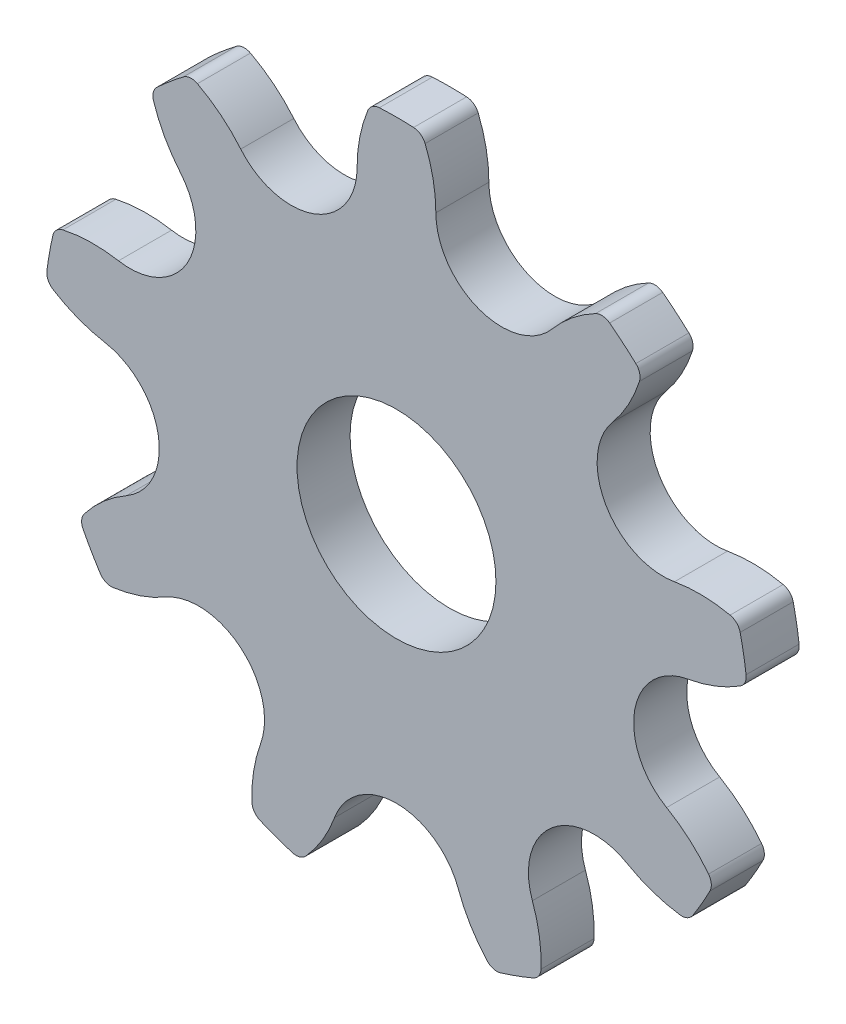
from build123d import *

# Parameters (mm, degrees)
BOSS_EXTRUDE1_DEPTH = 3.2
SKETCH2_R           = 6
CUT_EXTRUDE1_DEPTH  = 10


with BuildPart() as part:
    # Sketch1 → Boss-Extrude1 (new body)
    with BuildSketch(Plane.XY):
        with BuildLine():
            ThreePointArc((2.3749, 17.446481614), (2.211827147, 19.125468185), (1.72870442, 20.741692518))
            ThreePointArc((1.72870442, 20.741692518), (1.452377955, 21.089746522), (1.03228327, 21.234723622))
            ThreePointArc((1.03228327, 21.234723622), (0, 21.2598), (-1.03228327, 21.234723622))
            ThreePointArc((-1.03228327, 21.234723622), (-1.452377955, 21.089746522), (-1.72870442, 20.741692518))
            ThreePointArc((-1.72870442, 20.741692518), (-2.211827147, 19.125468185), (-2.3749, 17.446481614))
            ThreePointArc((-2.3749, 17.446481614), (-4.990435728, 13.711109477), (-9.395103266, 14.891336586))
            ThreePointArc((-9.395103266, 14.891336586), (-10.599256083, 16.07269371), (-12.00823854, 17.000248076))
            ThreePointArc((-12.00823854, 17.000248076), (-12.443641694, 17.089253684), (-12.858642377, 16.930280927))
            ThreePointArc((-12.858642377, 16.930280927), (-13.665536024, 16.285951652), (-14.440192102, 15.603203136))
            ThreePointArc((-14.440192102, 15.603203136), (-14.668813817, 15.222112575), (-14.656767369, 14.777868512))
            ThreePointArc((-14.656767369, 14.777868512), (-13.987971874, 13.22922354), (-13.033661162, 11.838223998))
            ThreePointArc((-13.033661162, 11.838223998), (-12.636226845, 7.295528971), (-16.769033299, 5.368369672))
            ThreePointArc((-16.769033299, 5.368369672), (-18.450829595, 5.49932722), (-20.12639323, 5.304198623))
            ThreePointArc((-20.12639323, 5.304198623), (-20.517143098, 5.092509122), (-20.732866347, 4.703971627))
            ThreePointArc((-20.732866347, 4.703971627), (-20.936815867, 3.691725528), (-21.091374564, 2.670770493))
            ThreePointArc((-21.091374564, 2.670770493), (-21.021548669, 2.23188298), (-20.726765974, 1.899315592))
            ThreePointArc((-20.726765974, 1.899315592), (-19.218989102, 1.142878174), (-17.593827413, 0.690729806))
            ThreePointArc((-17.593827413, 0.690729806), (-14.369386985, -2.533710622), (-16.296546284, -6.666517075))
            ThreePointArc((-16.296546284, -6.666517075), (-17.669054881, -7.647235594), (-18.827184848, -8.873744316))
            ThreePointArc((-18.827184848, -8.873744316), (-18.990445225, -9.287077056), (-18.905951734, -9.723378276))
            ThreePointArc((-18.905951734, -9.723378276), (-18.411526879, -10.6299), (-17.873668464, -11.511345346))
            ThreePointArc((-17.873668464, -11.511345346), (-17.538067269, -11.802669466), (-17.098480428, -11.867948202))
            ThreePointArc((-17.098480428, -11.867948202), (-15.457227734, -11.478232591), (-13.921646284, -10.779964538))
            ThreePointArc((-13.921646284, -10.779964538), (-9.378951257, -11.177398855), (-8.198724147, -15.582066393))
            ThreePointArc((-8.198724147, -15.582066393), (-8.619733019, -17.215571885), (-8.718527435, -18.899563668))
            ThreePointArc((-8.718527435, -18.899563668), (-8.577906975, -19.321136664), (-8.232732188, -19.60105142))
            ThreePointArc((-8.232732188, -19.60105142), (-7.271279843, -19.977677179), (-6.292674246, -20.307174764))
            ThreePointArc((-6.292674246, -20.307174764), (-5.848329281, -20.314621697), (-5.469625861, -20.082067135))
            ThreePointArc((-5.469625861, -20.082067135), (-4.462857721, -18.728550761), (-3.735372137, -17.206593669))
            ThreePointArc((-3.735372137, -17.206593669), (0, -14.591057941), (3.735372137, -17.206593669))
            ThreePointArc((3.735372137, -17.206593669), (4.462857721, -18.728550761), (5.469625861, -20.082067135))
            ThreePointArc((5.469625861, -20.082067135), (5.848329281, -20.314621697), (6.292674246, -20.307174764))
            ThreePointArc((6.292674246, -20.307174764), (7.271279843, -19.977677179), (8.232732188, -19.60105142))
            ThreePointArc((8.232732188, -19.60105142), (8.577906975, -19.321136664), (8.718527435, -18.899563668))
            ThreePointArc((8.718527435, -18.899563668), (8.619733019, -17.215571885), (8.198724147, -15.582066393))
            ThreePointArc((8.198724147, -15.582066393), (9.378951257, -11.177398855), (13.921646284, -10.779964538))
            ThreePointArc((13.921646284, -10.779964538), (15.457227734, -11.478232591), (17.098480428, -11.867948202))
            ThreePointArc((17.098480428, -11.867948202), (17.538067269, -11.802669466), (17.873668464, -11.511345346))
            ThreePointArc((17.873668464, -11.511345346), (18.411526879, -10.6299), (18.905951734, -9.723378276))
            ThreePointArc((18.905951734, -9.723378276), (18.990445225, -9.287077056), (18.827184848, -8.873744316))
            ThreePointArc((18.827184848, -8.873744316), (17.669054881, -7.647235594), (16.296546284, -6.666517075))
            ThreePointArc((16.296546284, -6.666517075), (14.369386985, -2.533710622), (17.593827413, 0.690729806))
            ThreePointArc((17.593827413, 0.690729806), (19.218989102, 1.142878174), (20.726765974, 1.899315592))
            ThreePointArc((20.726765974, 1.899315592), (21.021548669, 2.23188298), (21.091374564, 2.670770493))
            ThreePointArc((21.091374564, 2.670770493), (20.936815867, 3.691725528), (20.732866347, 4.703971627))
            ThreePointArc((20.732866347, 4.703971627), (20.517143098, 5.092509122), (20.12639323, 5.304198623))
            ThreePointArc((20.12639323, 5.304198623), (18.450829595, 5.49932722), (16.769033299, 5.368369672))
            ThreePointArc((16.769033299, 5.368369672), (12.636226845, 7.295528971), (13.033661162, 11.838223998))
            ThreePointArc((13.033661162, 11.838223998), (13.987971874, 13.22922354), (14.656767369, 14.777868512))
            ThreePointArc((14.656767369, 14.777868512), (14.668813817, 15.222112575), (14.440192102, 15.603203136))
            ThreePointArc((14.440192102, 15.603203136), (13.665536024, 16.285951652), (12.858642377, 16.930280927))
            ThreePointArc((12.858642377, 16.930280927), (12.443641694, 17.089253684), (12.00823854, 17.000248076))
            ThreePointArc((12.00823854, 17.000248076), (10.599256083, 16.07269371), (9.395103266, 14.891336586))
            ThreePointArc((9.395103266, 14.891336586), (4.990435728, 13.711109477), (2.3749, 17.446481614))
        make_face()
    extrude(amount=-BOSS_EXTRUDE1_DEPTH)

    # Sketch2 → Cut-Extrude1 (cut)
    with BuildSketch(Plane.XY):
        Circle(SKETCH2_R)
    extrude(amount=-CUT_EXTRUDE1_DEPTH, mode=Mode.SUBTRACT)


solid = part.part
